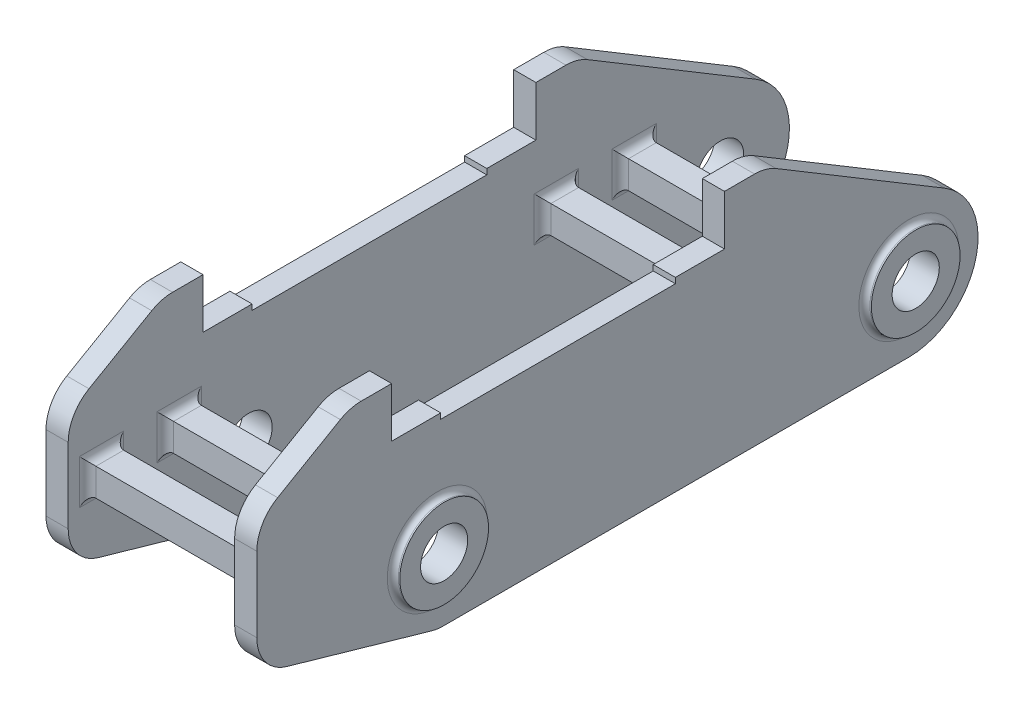
from build123d import *

# Parameters (mm, degrees)
SZKIC1_R                    = 8.5
DODANIE_WYCI_GNI_CIE1_DEPTH = 8
SZKIC2_R                    = 16
SZKIC2_R_2                  = 8.5
DODANIE_WYCI_GNI_CIE2_DEPTH = 2.5
ZAOKR_GLENIE1_R             = 2
DODANIE_WYCI_GNI_CIE3_REACH = 240.506
SZKIC3_W                    = 10
SZKIC3_H                    = 10
ZAOKR_GLENIE2_R             = 3


with BuildPart() as part:
    # Szkic1 → Dodanie-wyciągnięcie1 (new body)
    with BuildSketch(Plane(origin=(0, 0, 0), x_dir=(0, 0, -1), z_dir=(1, 0, 0))):
        with BuildLine():
            Line((0, 0), (-10.980762114, 0))
            ThreePointArc((-10.980762114, 0), (-14.86304779, -0.511112606), (-18.480762114, -2.009618943))
            Line((-18.480762114, -2.009618943), (-41.1, -15.068842026))
            ThreePointArc((-41.1, -15.068842026), (-46.590381057, -20.559223083), (-48.6, -28.059223083))
            Line((-48.6, -28.059223083), (-48.6, -55.049432524))
            ThreePointArc((-48.6, -55.049432524), (-45.579532651, -64.076657871), (-37.734560337, -69.468357963))
            Line((-37.734560337, -69.468357963), (14.404264621, -84.418925439))
            ThreePointArc((14.404264621, -84.418925439), (16.451228444, -84.854021031), (18.538824959, -85))
            Line((18.538824959, -85), (186.430712438, -85))
            ThreePointArc((186.430712438, -85), (210.491878328, -66.703464298), (199.290846236, -38.627855618))
            Line((199.290846236, -38.627855618), (138.569001646, -2.142490489))
            ThreePointArc((138.569001646, -2.142490489), (134.852006163, -0.545543202), (130.843430522, 0))
            Line((130.843430522, 0), (120.003298683, 0))
            Line((120.003298683, 0), (120.003298683, -18))
            Line((120.003298683, -18), (102.303298683, -18))
            Line((102.303298683, -18), (102.303298683, -20))
            Line((102.303298683, -20), (17.7, -20))
            Line((17.7, -20), (17.7, -18))
            Line((17.7, -18), (0, -18))
            Line((0, -18), (0, 0))
        make_face()
        with Locations((16.430712438, -60)):
            Circle(SZKIC1_R, mode=Mode.SUBTRACT)
        with Locations((186.430712438, -60)):
            Circle(SZKIC1_R, mode=Mode.SUBTRACT)
    extrude(amount=DODANIE_WYCI_GNI_CIE1_DEPTH)

    # Szkic2 → Dodanie-wyciągnięcie2 (add)
    # profile 1 of 2: a face of its own
    with BuildSketch(Plane(origin=(8, 0, 0), x_dir=(0, 0, -1), z_dir=(1, 0, 0))):
        with Locations((16.430712438, -60)):
            Circle(SZKIC2_R)
        with Locations((16.430712438, -60)):
            Circle(SZKIC2_R_2, mode=Mode.SUBTRACT)
    # profile 2 of 2: a face of its own
    with BuildSketch(Plane(origin=(8, 0, 0), x_dir=(0, 0, -1), z_dir=(1, 0, 0))):
        with Locations((186.430712438, -60)):
            Circle(SZKIC2_R)
        with Locations((186.430712438, -60)):
            Circle(SZKIC2_R_2, mode=Mode.SUBTRACT)
    extrude(amount=DODANIE_WYCI_GNI_CIE2_DEPTH)

    # Zaokrąglenie1
    zaokr_glenie1_edges = [part.edges().sort_by_distance(p)[0] for p in [
        (8, -60, -0.430712438),
        (8, -60, -170.430712438),
    ]]
    fillet(zaokr_glenie1_edges, radius=ZAOKR_GLENIE1_R)


with BuildPart() as body_2:
    # Lustro3: mirrored copy
    add(part.part.mirror(Plane.ZY.offset(30)))

    # Szkic3 → Dodanie-wyciągnięcie3 (add, up to next)
    with BuildSketch(Plane.ZY, mode=Mode.PRIVATE) as dodanie_wyci_gni_cie3_sk1:
        with Locations((8.6, -42.5)):
            Rectangle(SZKIC3_W, SZKIC3_H)
    dodanie_wyci_gni_cie3_tool1 = extrude(dodanie_wyci_gni_cie3_sk1.sketch, amount=DODANIE_WYCI_GNI_CIE3_REACH, mode=Mode.PRIVATE) - body_2.part
    # Szkic3 → Dodanie-wyciągnięcie3 (add, up to next)
    with BuildSketch(Plane.ZY, mode=Mode.PRIVATE) as dodanie_wyci_gni_cie3_sk2:
        with Locations((36.6, -42.5)):
            Rectangle(SZKIC3_W, SZKIC3_H)
    dodanie_wyci_gni_cie3_tool2 = extrude(dodanie_wyci_gni_cie3_sk2.sketch, amount=DODANIE_WYCI_GNI_CIE3_REACH, mode=Mode.PRIVATE) - body_2.part
    # Szkic3 → Dodanie-wyciągnięcie3 (add, up to next)
    with BuildSketch(Plane.ZY, mode=Mode.PRIVATE) as dodanie_wyci_gni_cie3_sk3:
        with Locations((-155.4, -42.5)):
            Rectangle(SZKIC3_W, SZKIC3_H)
    dodanie_wyci_gni_cie3_tool3 = extrude(dodanie_wyci_gni_cie3_sk3.sketch, amount=DODANIE_WYCI_GNI_CIE3_REACH, mode=Mode.PRIVATE) - body_2.part
    # Szkic3 → Dodanie-wyciągnięcie3 (add, up to next)
    with BuildSketch(Plane.ZY, mode=Mode.PRIVATE) as dodanie_wyci_gni_cie3_sk4:
        with Locations((-127.4, -42.5)):
            Rectangle(SZKIC3_W, SZKIC3_H)
    dodanie_wyci_gni_cie3_tool4 = extrude(dodanie_wyci_gni_cie3_sk4.sketch, amount=DODANIE_WYCI_GNI_CIE3_REACH, mode=Mode.PRIVATE) - body_2.part

    add(part.part)  # Dodanie-wyciągnięcie3 merges part
    add(dodanie_wyci_gni_cie3_tool1.solids().sort_by_distance((0, -42.5, 8.6))[0])
    add(dodanie_wyci_gni_cie3_tool2.solids().sort_by_distance((0, -42.5, 36.6))[0])
    add(dodanie_wyci_gni_cie3_tool3.solids().sort_by_distance((0, -42.5, -155.4))[0])
    add(dodanie_wyci_gni_cie3_tool4.solids().sort_by_distance((0, -42.5, -127.4))[0])

    # Zaokrąglenie2
    zaokr_glenie2_edges = [body_2.edges().sort_by_distance(p)[0] for p in [
        (-60, -42.5, 31.6),
        (-60, -47.5, 36.6),
        (-60, -42.5, 41.6),
        (-60, -37.5, 36.6),
        (0, -47.5, 36.6),
        (0, -42.5, 31.6),
        (0, -42.5, 41.6),
        (0, -37.5, 36.6),
        (-60, -42.5, -160.4),
        (-60, -47.5, -155.4),
        (-60, -42.5, -150.4),
        (-60, -37.5, -155.4),
        (0, -42.5, -160.4),
        (0, -47.5, -155.4),
        (0, -42.5, -150.4),
        (0, -37.5, -155.4),
        (-60, -42.5, -132.4),
        (-60, -47.5, -127.4),
        (-60, -42.5, -122.4),
        (-60, -37.5, -127.4),
        (0, -47.5, -127.4),
        (0, -42.5, -132.4),
        (0, -42.5, -122.4),
        (0, -37.5, -127.4),
        (-60, -42.5, 3.6),
        (-60, -47.5, 8.6),
        (-60, -42.5, 13.6),
        (-60, -37.5, 8.6),
        (0, -47.5, 8.6),
        (0, -42.5, 3.6),
        (0, -42.5, 13.6),
        (0, -37.5, 8.6),
    ]]
    fillet(zaokr_glenie2_edges, radius=ZAOKR_GLENIE2_R)


solid = body_2.part
